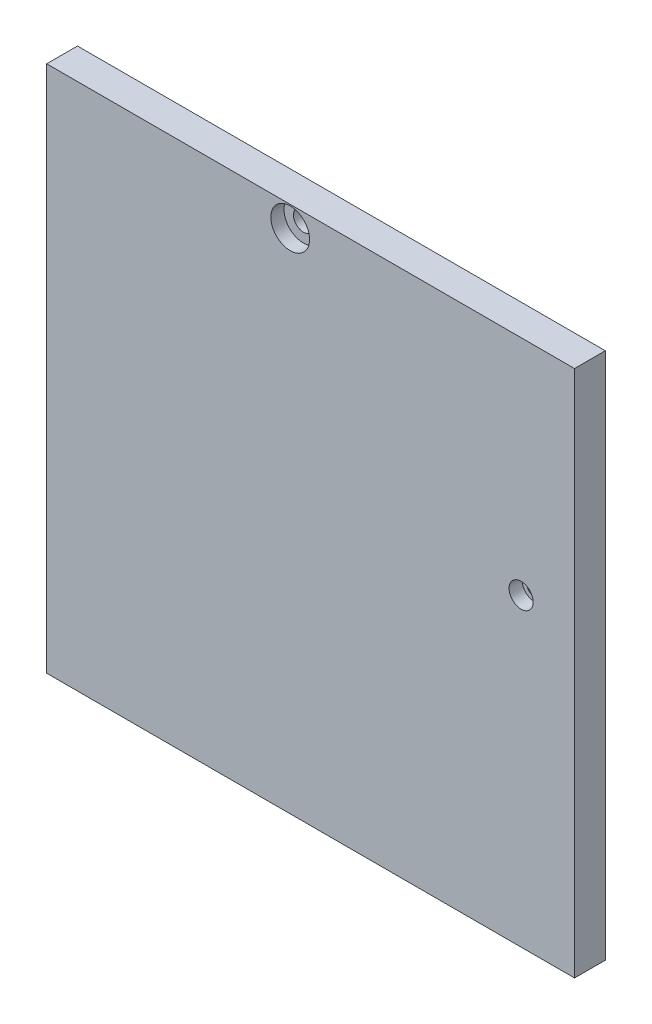
from build123d import *

# Parameters (mm, degrees)
SKETCH_5_W          = 120
SKETCH_5_H          = 120
EXTRUDE_2_DEPTH     = 7
SKETCH_6_R          = 2.261709603
CUT_EXTRUDE_1_DEPTH = 7
SKETCH_9_R          = 4.406880206
CUT_EXTRUDE_2_DEPTH = 3
SKETCH_10_R         = 1.755844697
CUT_EXTRUDE_3_DEPTH = 7
SKETCH_11_R         = 2.744907592
CUT_EXTRUDE_4_DEPTH = 3


with BuildPart() as part:
    # 草图5 → 凸台-拉伸2 (new body)
    with BuildSketch(Plane.XY):
        with Locations((4.638432047, 17.423222422)):
            Rectangle(SKETCH_5_W, SKETCH_5_H)
    extrude(amount=EXTRUDE_2_DEPTH)

    # 草图6 → 切除-拉伸1 (cut)
    with BuildSketch(Plane.XY.offset(7)):
        with Locations((0, 72.710313561)):
            Circle(SKETCH_6_R)
    extrude(amount=-CUT_EXTRUDE_1_DEPTH, mode=Mode.SUBTRACT)

    # 草图9 → 切除-拉伸2 (cut)
    with BuildSketch(Plane.XY.offset(7)):
        with Locations((0, 72.710313561)):
            Circle(SKETCH_9_R)
    extrude(amount=-CUT_EXTRUDE_2_DEPTH, mode=Mode.SUBTRACT)

    # 草图10 → 切除-拉伸3 (cut)
    with BuildSketch(Plane.XY.offset(7)):
        with Locations((52.5, 26.710313561)):
            Circle(SKETCH_10_R)
    extrude(amount=-CUT_EXTRUDE_3_DEPTH, mode=Mode.SUBTRACT)

    # 草图11 → 切除-拉伸4 (cut)
    with BuildSketch(Plane.XY.offset(7)):
        with Locations((52.5, 26.710313561)):
            Circle(SKETCH_11_R)
    extrude(amount=-CUT_EXTRUDE_4_DEPTH, mode=Mode.SUBTRACT)


solid = part.part
